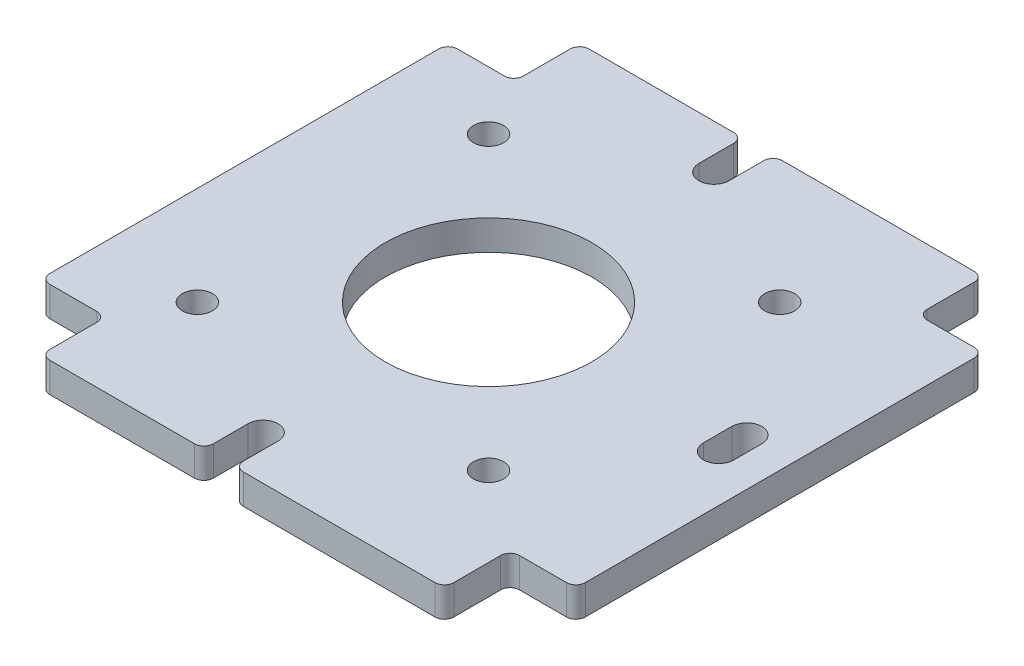
from build123d import *

# Parameters (mm, degrees)
SKETCH1_W            = 42
SKETCH1_H            = 42
SKETCH1_R            = 11
BOSS_EXTRUDE1_DEPTH  = 1.5875
M3_CLEARANCE_HOLE1_D = 3.2
SKETCH4_W            = 5
SKETCH4_H            = 42
SKETCH4_W_2          = 10
SKETCH4_H_2          = 28
BOSS_EXTRUDE2_DEPTH  = 3.175
SKETCH5_W            = 7
SKETCH5_H            = 0.7
BOSS_EXTRUDE3_DEPTH  = 3.175
FILLET1_R            = 1


with BuildPart() as part:
    # Sketch1 → Boss-Extrude1 (new, symmetric)
    with BuildSketch(Plane(origin=(0, 0, 0), x_dir=(1, 0, 0), z_dir=(0, 1, 0))):
        Rectangle(SKETCH1_W, SKETCH1_H)
        with Locations(Location((0, 0, 0), (0, 0, 270))):
            Circle(SKETCH1_R, mode=Mode.SUBTRACT)
    extrude(amount=BOSS_EXTRUDE1_DEPTH, both=True)

    # M3 Clearance Hole1 (through all)
    with Locations(Plane(origin=(0, 1.5875, 0), x_dir=(1, 0, 0), z_dir=(0, 1, 0))):
        with Locations((-15.5, 15.5), (15.5, 15.5), (15.5, -15.5), (-15.5, -15.5)):
            Hole(M3_CLEARANCE_HOLE1_D / 2)

    # Sketch4 → Boss-Extrude2 (add)
    # profile 1 of 4: a face of its own
    with BuildSketch(Plane(origin=(0, 1.5875, 0), x_dir=(1, 0, 0), z_dir=(0, 1, 0))):
        with BuildLine():
            Line((1.6, -24), (1.6, -28.7))
            Line((1.6, -28.7), (14, -28.7))
            Line((14, -28.7), (14, -21))
            Line((14, -21), (-19, -21))
            Line((-19, -21), (-19, -28.7))
            Line((-19, -28.7), (-1.6, -28.7))
            Line((-1.6, -28.7), (-1.6, -24))
            ThreePointArc((-1.6, -24), (0, -22.4), (1.6, -24))
        make_face()
    # profile 2 of 4: a face of its own
    with BuildSketch(Plane(origin=(0, 1.5875, 0), x_dir=(1, 0, 0), z_dir=(0, 1, 0))):
        with Locations((-23.5, 0)):
            Rectangle(SKETCH4_W, SKETCH4_H)
    # profile 3 of 4: a face of its own
    with BuildSketch(Plane(origin=(0, 1.5875, 0), x_dir=(1, 0, 0), z_dir=(0, 1, 0))):
        with BuildLine():
            Line((1.6, 28.7), (14, 28.7))
            Line((14, 28.7), (14, 21))
            Line((14, 21), (-19, 21))
            Line((-19, 21), (-19, 28.7))
            Line((-19, 28.7), (-1.6, 28.7))
            Line((-1.6, 28.7), (-1.6, 24))
            ThreePointArc((-1.6, 24), (0, 22.4), (1.6, 24))
            Line((1.6, 24), (1.6, 28.7))
        make_face()
    # profile 4 of 4: a face of its own
    with BuildSketch(Plane(origin=(0, 1.5875, 0), x_dir=(1, 0, 0), z_dir=(0, 1, 0))):
        with Locations((26, 0)):
            Rectangle(SKETCH4_W_2, SKETCH4_H_2)
        with BuildLine():
            Line((27.6, 1.5), (27.6, -1.5))
            ThreePointArc((27.6, -1.5), (26, -3.1), (24.4, -1.5))
            Line((24.4, -1.5), (24.4, 1.5))
            ThreePointArc((24.4, 1.5), (26, 3.1), (27.6, 1.5))
        make_face(mode=Mode.SUBTRACT)
    extrude(amount=-BOSS_EXTRUDE2_DEPTH)

    # Sketch5 → Boss-Extrude3 (add)
    with BuildSketch(Plane(origin=(0, 1.5875, 0), x_dir=(1, 0, 0), z_dir=(0, 1, 0))):
        Polygon((21, 14), (31, 14), (31, 21.7), (24, 21.7), (24, 28.7), (14, 28.7), (14, 21), (21, 21), align=None)
        Polygon((31, -14), (21, -14), (21, -21), (14, -21), (14, -28.7), (24, -28.7), (24, -21.7), (31, -21.7), align=None)
        with Locations((-22.5, -21.35)):
            Rectangle(SKETCH5_W, SKETCH5_H)
        with Locations((-22.5, 21.35)):
            Rectangle(SKETCH5_W, SKETCH5_H)
    extrude(amount=-BOSS_EXTRUDE3_DEPTH)

    # Fillet1
    fillet1_edges = [part.edges().sort_by_distance(p)[0] for p in [
        (-26, 0, 21.7),
        (31, 0, -21.7),
        (-19, 0, -21.7),
        (24, 0, -28.7),
        (24, 0, -21.7),
        (31, 0, 21.7),
        (24, 0, 21.7),
        (24, 0, 28.7),
        (-19, 0, 21.7),
        (-26, 0, -21.7),
        (-1.6, 0, 28.7),
        (-19, 0, 28.7),
        (1.6, 0, 28.7),
        (1.6, 0, -28.7),
        (-19, 0, -28.7),
        (-1.6, 0, -28.7),
    ]]
    fillet(fillet1_edges, radius=FILLET1_R)


solid = part.part
